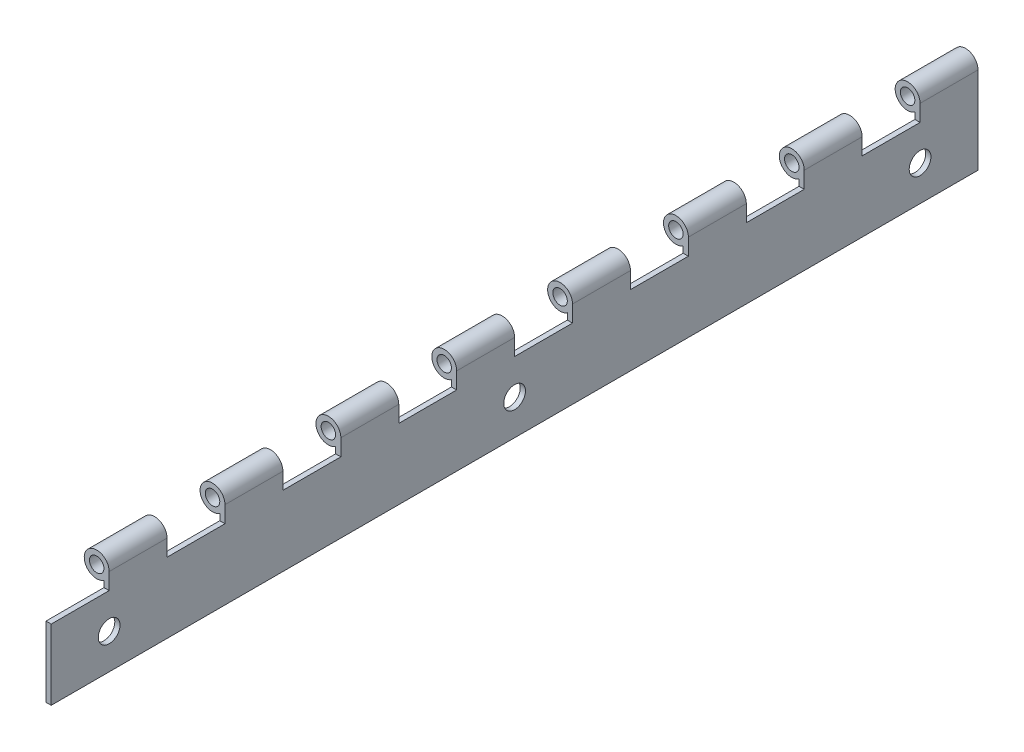
from build123d import *

# Parameters (mm, degrees)
SKETCH1_R           = 3.175
BOSS_EXTRUDE1_DEPTH = 406.4
SKETCH2_W           = 25.4
SKETCH2_H           = 12.7
CUT_EXTRUDE1_DEPTH  = 409.328127961
LPATTERN1_COUNT     = 8
LPATTERN1_PITCH     = 50.8
SKETCH3_R           = 4.7625
CUT_EXTRUDE2_DEPTH  = 409.273377158


with BuildPart() as part:
    # Sketch1 → Boss-Extrude1 (new body)
    with BuildSketch(Plane.XY):
        with BuildLine():
            Line((5.461, 0), (5.461, -38.1))
            Line((5.461, -38.1), (3.175, -38.1))
            Line((3.175, -38.1), (3.175, -4.443185344))
            ThreePointArc((3.175, -4.443185344), (-4.855985791, 2.498384078), (5.461, 0))
        make_face()
        Circle(SKETCH1_R, mode=Mode.SUBTRACT)
    extrude(amount=BOSS_EXTRUDE1_DEPTH)

    # Sketch2 → Cut-Extrude1 (cut, through all)
    with BuildSketch(Plane(origin=(5.461, 0, 0), x_dir=(0, 0, -1), z_dir=(1, 0, 0))):
        with Locations((-393.7, -0.889)):
            Rectangle(SKETCH2_W, SKETCH2_H)
    cut_extrude1 = extrude(amount=-CUT_EXTRUDE1_DEPTH, mode=Mode.SUBTRACT)

    # LPattern1: Cut-Extrude1 ×8
    with Locations(*[(0, 0, -i * LPATTERN1_PITCH) for i in range(1, LPATTERN1_COUNT)]):
        add(cut_extrude1, mode=Mode.SUBTRACT)

    # Sketch3 → Cut-Extrude2 (cut, through all)
    with BuildSketch(Plane.ZY.offset(-3.175)):
        with Locations(Location((25.4, -22.6695, 0), (0, 0, 270))):
            Circle(SKETCH3_R)
        with Locations(Location((203.2, -22.6695, 0), (0, 0, 270))):
            Circle(SKETCH3_R)
        with Locations(Location((381, -22.6695, 0), (0, 0, 270))):
            Circle(SKETCH3_R)
    extrude(amount=-CUT_EXTRUDE2_DEPTH, mode=Mode.SUBTRACT)


solid = part.part
